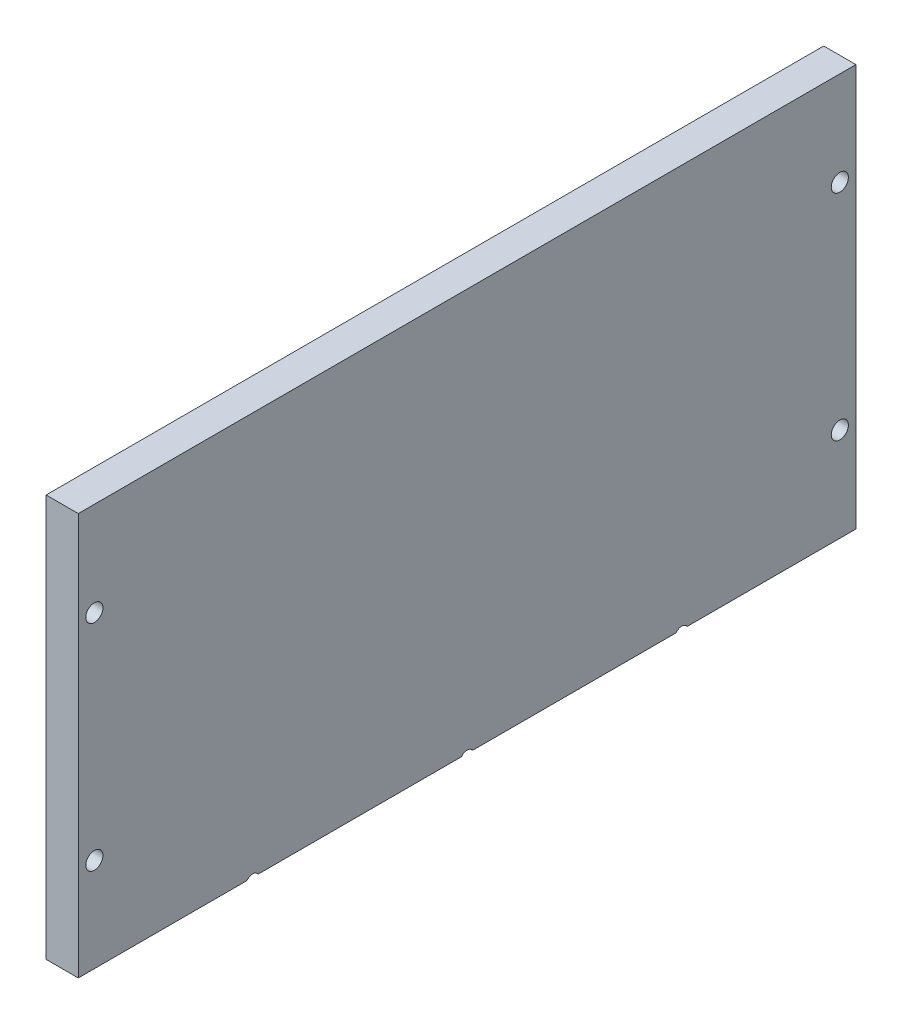
from build123d import *

# Parameters (mm, degrees)
SKETCH_1_W          = 300
SKETCH_1_H          = 145
EXTRUDE_1_DEPTH     = 81
SHELL_1_T           = -6
SKETCH_2_R          = 2.55
CUT_EXTRUDE_1_DEPTH = 183.705363906
SKETCH_3_R          = 4.25
CUT_EXTRUDE_2_DEPTH = 3
SKETCH_4_W          = 145
SKETCH_4_H          = 81
CUT_EXTRUDE_3_DEPTH = 314.453744594
SKETCH_5_W          = 145
SKETCH_5_H          = 6
CUT_EXTRUDE_4_DEPTH = 109.872632006
SKETCH_6_R          = 1.6
SKETCH_6_R_2        = 1.25
CUT_EXTRUDE_5_DEPTH = 109.872632006
SKETCH_7_R          = 2.95
CUT_EXTRUDE_6_DEPTH = 3
SKETCH_8_R          = 1.5
CUT_EXTRUDE_7_DEPTH = 10


with BuildPart() as part:
    # ｽｹｯﾁ1 → ﾎﾞｽ - 押し出し1 (new body)
    with BuildSketch(Plane(origin=(0, 0, 0), x_dir=(1, 0, 0), z_dir=(0, 1, 0))):
        Rectangle(SKETCH_1_W, SKETCH_1_H)
    extrude(amount=EXTRUDE_1_DEPTH)

    # ｼｪﾙ1
    shell_1_openings = [part.faces().sort_by_distance(p)[0] for p in [
        (0, 81, 0),
    ]]
    offset(amount=SHELL_1_T, openings=shell_1_openings, kind=Kind.INTERSECTION)

    # ｽｹｯﾁ2 → ｶｯﾄ - 押し出し1 (cut, through all)
    with BuildSketch(Plane(origin=(0, 6, 0), x_dir=(1, 0, 0), z_dir=(0, 1, 0))):
        with Locations(Location((140, 60, 0), (0, 0, 270))):
            Circle(SKETCH_2_R)
        with Locations(Location((140, -60, 0), (0, 0, 90))):
            Circle(SKETCH_2_R)
        with Locations(Location((-22.5, -60, 0), (0, 0, 270))):
            Circle(SKETCH_2_R)
        with Locations(Location((-22.5, 60, 0), (0, 0, 90))):
            Circle(SKETCH_2_R)
    extrude(amount=-CUT_EXTRUDE_1_DEPTH, mode=Mode.SUBTRACT)

    # ｽｹｯﾁ3 → ｶｯﾄ - 押し出し2 (cut)
    with BuildSketch(Plane(origin=(0, 6, 0), x_dir=(1, 0, 0), z_dir=(0, 1, 0))):
        with Locations(Location((140, 60, 0), (0, 0, 270))):
            Circle(SKETCH_3_R)
        with Locations(Location((-22.5, 60, 0), (0, 0, 270))):
            Circle(SKETCH_3_R)
        with Locations(Location((-22.5, -60, 0), (0, 0, 270))):
            Circle(SKETCH_3_R)
        with Locations(Location((140, -60, 0), (0, 0, 270))):
            Circle(SKETCH_3_R)
    extrude(amount=-CUT_EXTRUDE_2_DEPTH, mode=Mode.SUBTRACT)

    # ｽｹｯﾁ4 → ｶｯﾄ - 押し出し3 (cut, through all)
    with BuildSketch(Plane.ZY.offset(-144)):
        with Locations((0, 40.5)):
            Rectangle(SKETCH_4_W, SKETCH_4_H)
    extrude(amount=CUT_EXTRUDE_3_DEPTH, mode=Mode.SUBTRACT)

    # ｽｹｯﾁ5 → ｶｯﾄ - 押し出し4 (cut, through all)
    with BuildSketch(Plane.ZY.offset(-144)):
        with Locations((0, 3)):
            Rectangle(SKETCH_5_W, SKETCH_5_H)
    extrude(amount=-CUT_EXTRUDE_4_DEPTH, mode=Mode.SUBTRACT)

    # ｽｹｯﾁ6 → ｶｯﾄ - 押し出し5 (cut, through all)
    with BuildSketch(Plane.ZY.offset(-144)):
        with Locations((-69.5, 63.5)):
            Circle(SKETCH_6_R)
        with Locations(Location((-69.5, 23.5, 0), (0, 0, 180))):
            Circle(SKETCH_6_R)
        with Locations((69.5, 23.5)):
            Circle(SKETCH_6_R)
        with Locations(Location((69.5, 63.5, 0), (0, 0, 180))):
            Circle(SKETCH_6_R)
        with Locations((-40, 5.3)):
            Circle(SKETCH_6_R_2)
        with Locations((0, 5.3)):
            Circle(SKETCH_6_R_2)
        with Locations((40, 5.3)):
            Circle(SKETCH_6_R_2)
    extrude(amount=-CUT_EXTRUDE_5_DEPTH, mode=Mode.SUBTRACT)

    # ｽｹｯﾁ7 → ｶｯﾄ - 押し出し6 (cut)
    with BuildSketch(Plane.ZY.offset(-144)):
        with Locations((-69.5, 63.5)):
            Circle(SKETCH_7_R)
        with Locations((-69.5, 23.5)):
            Circle(SKETCH_7_R)
        with Locations((69.5, 63.5)):
            Circle(SKETCH_7_R)
        with Locations((69.5, 23.5)):
            Circle(SKETCH_7_R)
    extrude(amount=-CUT_EXTRUDE_6_DEPTH, mode=Mode.SUBTRACT)

    # ｽｹｯﾁ8 → ｶｯﾄ - 押し出し7 (cut)
    with BuildSketch(Plane.XZ.offset(-6)):
        with Locations(Location((147, 40, 0), (0, 0, 270))):
            Circle(SKETCH_8_R)
        with Locations(Location((147, -0.025, 0), (0, 0, 270))):
            Circle(SKETCH_8_R)
        with Locations(Location((147, -40, 0), (0, 0, 270))):
            Circle(SKETCH_8_R)
    extrude(amount=-CUT_EXTRUDE_7_DEPTH, mode=Mode.SUBTRACT)


solid = part.part
